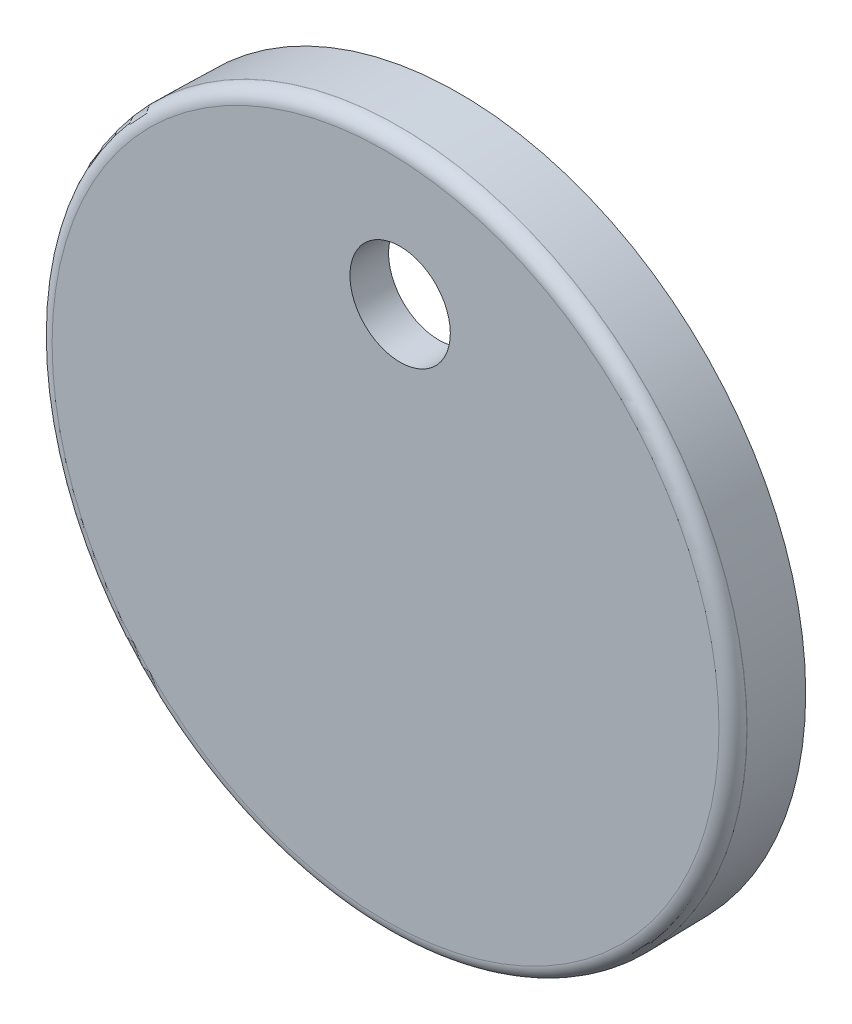
from build123d import *

# Parameters (mm, degrees)
SKETCH1_R           = 49.5
BOSS_EXTRUDE1_DEPTH = 2
BOSS_EXTRUDE1_TAPER = 1
SKETCH2_R           = 4
HOLDER_DEPTH        = 15
HOLDERCUT_DEPTH     = 5
FILLET1_R           = 2
SKETCH6_R           = 7.15
CAMCUT_DEPTH        = 11
CAMCUT_DRAFT        = -1
CUT_EXTRUDE1_DEPTH  = 10
SKETCH8_R           = 49.5
BOSS_EXTRUDE2_DEPTH = 8.5
BOSS_EXTRUDE2_TAPER = 1
SKETCH9_R           = 47.851631948
SKETCH9_R_2         = 4
CUT_EXTRUDE5_DEPTH  = 5
SKETCH10_R          = 7.15
CUT_EXTRUDE6_DEPTH  = 10


with BuildPart() as part:
    # Sketch1 → Boss-Extrude1 (new body)
    with BuildSketch(Plane.XY):
        Circle(SKETCH1_R)
    extrude(amount=BOSS_EXTRUDE1_DEPTH, taper=BOSS_EXTRUDE1_TAPER)

    # Sketch2 → Holder (add)
    with BuildSketch(Plane.XY.offset(2)):
        with Locations((0.029161528, 0.006821447)):
            Circle(SKETCH2_R)
    extrude(amount=-HOLDER_DEPTH)

    # Sketch5 → HolderCut (cut)
    with BuildSketch(Plane(origin=(0, 0, -13), x_dir=(-1, 0, 0), z_dir=(0, 0, -1))):
        with BuildLine():
            Line((-1.576483824, 2.191962306), (-1.576483824, -2.191962306))
            ThreePointArc((-1.576483824, -2.191962306), (2.7, 0), (-1.576483824, 2.191962306))
        make_face()
    extrude(amount=-HOLDERCUT_DEPTH, mode=Mode.SUBTRACT)

    # Fillet1
    fillet1_edges = [part.edges().sort_by_distance(p)[0] for p in [
        (-49.46508987, 0, 2),
    ]]
    fillet(fillet1_edges, radius=FILLET1_R)


with BuildPart() as camcut_tool:
    # Sketch6 → CamCut (with draft: the straight prism first)
    with BuildSketch(Plane.XY.offset(2)):
        with Locations((2.075653978, 29.594808325)):
            Circle(SKETCH6_R)
    extrude(amount=-CAMCUT_DEPTH)
    # CamCut: the draft: its side faces are tilted about the plane it starts from
    camcut_sides = [camcut_tool.faces().sort_by_distance(p)[0] for p in [
        (-5.074346022, 29.594808325, -3.5),
    ]]
    draft(camcut_sides, Plane.XY.offset(2), CAMCUT_DRAFT)


with BuildPart() as part_1:
    add(part.part)

    # CamCut: cut by camcut_tool
    add(camcut_tool.part, mode=Mode.SUBTRACT)

    # Sketch7 → Cut-Extrude1 (cut)
    with BuildSketch(Plane(origin=(0, 0, -13), x_dir=(-1, 0, 0), z_dir=(0, 0, -1))):
        with BuildLine():
            Line((-1.676483824, 2.242632825), (-1.676483824, -2.242632825))
            ThreePointArc((-1.676483824, -2.242632825), (2.8, 0), (-1.676483824, 2.242632825))
        make_face()
    extrude(amount=-CUT_EXTRUDE1_DEPTH, mode=Mode.SUBTRACT)

    # Sketch8 → Boss-Extrude2 (add)
    with BuildSketch(Plane(origin=(0, 0, 0), x_dir=(-1, 0, 0), z_dir=(0, 0, -1))):
        Circle(SKETCH8_R)
    extrude(amount=BOSS_EXTRUDE2_DEPTH, taper=BOSS_EXTRUDE2_TAPER)

    # Sketch9 → Cut-Extrude5 (cut)
    with BuildSketch(Plane(origin=(0, 0, -8.5), x_dir=(-1, 0, 0), z_dir=(0, 0, -1))):
        Circle(SKETCH9_R)
        Circle(SKETCH9_R_2, mode=Mode.SUBTRACT)
    extrude(amount=-CUT_EXTRUDE5_DEPTH, mode=Mode.SUBTRACT)

    # Sketch10 → Cut-Extrude6 (cut)
    with BuildSketch(Plane.XY.offset(2)):
        with Locations((2.075653978, 29.594808325)):
            Circle(SKETCH10_R)
    extrude(amount=-CUT_EXTRUDE6_DEPTH, mode=Mode.SUBTRACT)


solid = part_1.part
